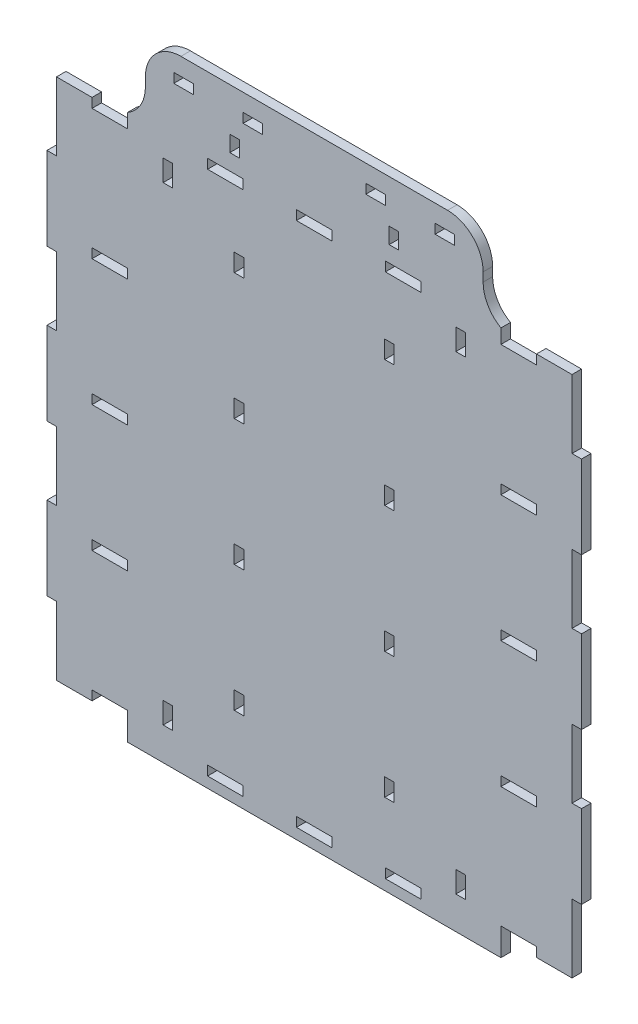
from build123d import *

# Parameters (mm, degrees)
MODEL_W             = 20
MODEL_H             = 5.35
MODEL_W_2           = 5.35
MODEL_H_2           = 10
MODEL_H_3           = 12
MODEL_W_3           = 11
MODEL_H_4           = 9
BOSS_EXTRUDE1_DEPTH = 5.35


with BuildPart() as part:
    # Model → Boss-Extrude1 (new body)
    with BuildSketch(Plane.XY):
        with BuildLine():
            Line((125, 304.11), (145, 304.11))
            Line((145, 304.11), (145, 265.61))
            Line((145, 265.61), (150.35, 265.61))
            Line((150.35, 265.61), (150.35, 218.943333333))
            Line((150.35, 218.943333333), (145, 218.943333333))
            Line((145, 218.943333333), (145, 180.443333333))
            Line((145, 180.443333333), (150.35, 180.443333333))
            Line((150.35, 180.443333333), (150.35, 133.776666667))
            Line((150.35, 133.776666667), (145, 133.776666667))
            Line((145, 133.776666667), (145, 95.276666667))
            Line((145, 95.276666667), (150.35, 95.276666667))
            Line((150.35, 95.276666667), (150.35, 48.61))
            Line((150.35, 48.61), (145, 48.61))
            Line((145, 48.61), (145, 10.11))
            Line((145, 10.11), (125, 10.11))
            Line((125, 10.11), (125, 15.46))
            Line((125, 15.46), (105, 15.46))
            Line((105, 15.46), (105, 0))
            Line((105, 0), (-105, 0))
            Line((-105, 0), (-105, 15.46))
            Line((-105, 15.46), (-125, 15.46))
            Line((-125, 15.46), (-125, 10.11))
            Line((-125, 10.11), (-145, 10.11))
            Line((-145, 10.11), (-145, 48.61))
            Line((-145, 48.61), (-150.35, 48.61))
            Line((-150.35, 48.61), (-150.35, 95.276666667))
            Line((-150.35, 95.276666667), (-145, 95.276666667))
            Line((-145, 95.276666667), (-145, 133.776666667))
            Line((-145, 133.776666667), (-150.35, 133.776666667))
            Line((-150.35, 133.776666667), (-150.35, 180.443333333))
            Line((-150.35, 180.443333333), (-145, 180.443333333))
            Line((-145, 180.443333333), (-145, 218.943333333))
            Line((-145, 218.943333333), (-150.35, 218.943333333))
            Line((-150.35, 218.943333333), (-150.35, 265.61))
            Line((-150.35, 265.61), (-145, 265.61))
            Line((-145, 265.61), (-145, 304.11))
            Line((-145, 304.11), (-125, 304.11))
            Line((-125, 304.11), (-125, 298.76))
            Line((-125, 298.76), (-105, 298.76))
            Line((-105, 298.76), (-105, 306.789491924))
            ThreePointArc((-105, 306.789491924), (-97.679491924, 314.11), (-95, 324.11))
            Line((-95, 324.11), (-95, 329.11))
            ThreePointArc((-95, 329.11), (-89.142135624, 343.252135624), (-75, 349.11))
            Line((-75, 349.11), (75, 349.11))
            ThreePointArc((75, 349.11), (89.142135624, 343.252135624), (95, 329.11))
            Line((95, 329.11), (95, 324.11))
            ThreePointArc((95, 324.11), (97.679491924, 314.11), (105, 306.789491924))
            Line((105, 306.789491924), (105, 298.76))
            Line((105, 298.76), (125, 298.76))
            Line((125, 298.76), (125, 304.11))
        make_face()
        with Locations((-115, 157.11)):
            Rectangle(MODEL_W, MODEL_H, mode=Mode.SUBTRACT)
        with Locations((-115, 228.19)):
            Rectangle(MODEL_W, MODEL_H, mode=Mode.SUBTRACT)
        with Locations((-115, 86.03)):
            Rectangle(MODEL_W, MODEL_H, mode=Mode.SUBTRACT)
        with Locations((-42.325, 192.65)):
            Rectangle(MODEL_W_2, MODEL_H_2, mode=Mode.SUBTRACT)
        with Locations((-42.325, 263.73)):
            Rectangle(MODEL_W_2, MODEL_H_2, mode=Mode.SUBTRACT)
        with Locations((-42.325, 121.57)):
            Rectangle(MODEL_W_2, MODEL_H_2, mode=Mode.SUBTRACT)
        with Locations((-42.325, 50.49)):
            Rectangle(MODEL_W_2, MODEL_H_2, mode=Mode.SUBTRACT)
        with Locations((-50, 304.275)):
            Rectangle(MODEL_W, MODEL_H, mode=Mode.SUBTRACT)
        with Locations((0, 8.675)):
            Rectangle(MODEL_W, MODEL_H, mode=Mode.SUBTRACT)
        with Locations((-82.325, 288.6)):
            Rectangle(MODEL_W_2, MODEL_H_3, mode=Mode.SUBTRACT)
        with Locations((-50, 8.675)):
            Rectangle(MODEL_W, MODEL_H, mode=Mode.SUBTRACT)
        with Locations((-82.325, 24.35)):
            Rectangle(MODEL_W_2, MODEL_H_3, mode=Mode.SUBTRACT)
        with Locations((0, 304.275)):
            Rectangle(MODEL_W, MODEL_H, mode=Mode.SUBTRACT)
        with Locations((-73.5, 336.625)):
            Rectangle(MODEL_W_3, MODEL_H, mode=Mode.SUBTRACT)
        with Locations((-44.825, 320.45)):
            Rectangle(MODEL_W_2, MODEL_H_4, mode=Mode.SUBTRACT)
        with Locations((-34.5, 336.625)):
            Rectangle(MODEL_W_3, MODEL_H, mode=Mode.SUBTRACT)
        with Locations((50, 304.275)):
            Rectangle(MODEL_W, MODEL_H, mode=Mode.SUBTRACT)
        with Locations((44.825, 320.45)):
            Rectangle(MODEL_W_2, MODEL_H_4, mode=Mode.SUBTRACT)
        with Locations((34.5, 336.625)):
            Rectangle(MODEL_W_3, MODEL_H, mode=Mode.SUBTRACT)
        with Locations((73.5, 336.625)):
            Rectangle(MODEL_W_3, MODEL_H, mode=Mode.SUBTRACT)
        with Locations((115, 86.03)):
            Rectangle(MODEL_W, MODEL_H, mode=Mode.SUBTRACT)
        with Locations((115, 157.11)):
            Rectangle(MODEL_W, MODEL_H, mode=Mode.SUBTRACT)
        with Locations((115, 228.19)):
            Rectangle(MODEL_W, MODEL_H, mode=Mode.SUBTRACT)
        with Locations((82.325, 288.6)):
            Rectangle(MODEL_W_2, MODEL_H_3, mode=Mode.SUBTRACT)
        with Locations((42.325, 263.73)):
            Rectangle(MODEL_W_2, MODEL_H_2, mode=Mode.SUBTRACT)
        with Locations((42.325, 192.65)):
            Rectangle(MODEL_W_2, MODEL_H_2, mode=Mode.SUBTRACT)
        with Locations((42.325, 121.57)):
            Rectangle(MODEL_W_2, MODEL_H_2, mode=Mode.SUBTRACT)
        with Locations((42.325, 50.49)):
            Rectangle(MODEL_W_2, MODEL_H_2, mode=Mode.SUBTRACT)
        with Locations((82.325, 24.35)):
            Rectangle(MODEL_W_2, MODEL_H_3, mode=Mode.SUBTRACT)
        with Locations((50, 8.675)):
            Rectangle(MODEL_W, MODEL_H, mode=Mode.SUBTRACT)
    extrude(amount=BOSS_EXTRUDE1_DEPTH)


solid = part.part
